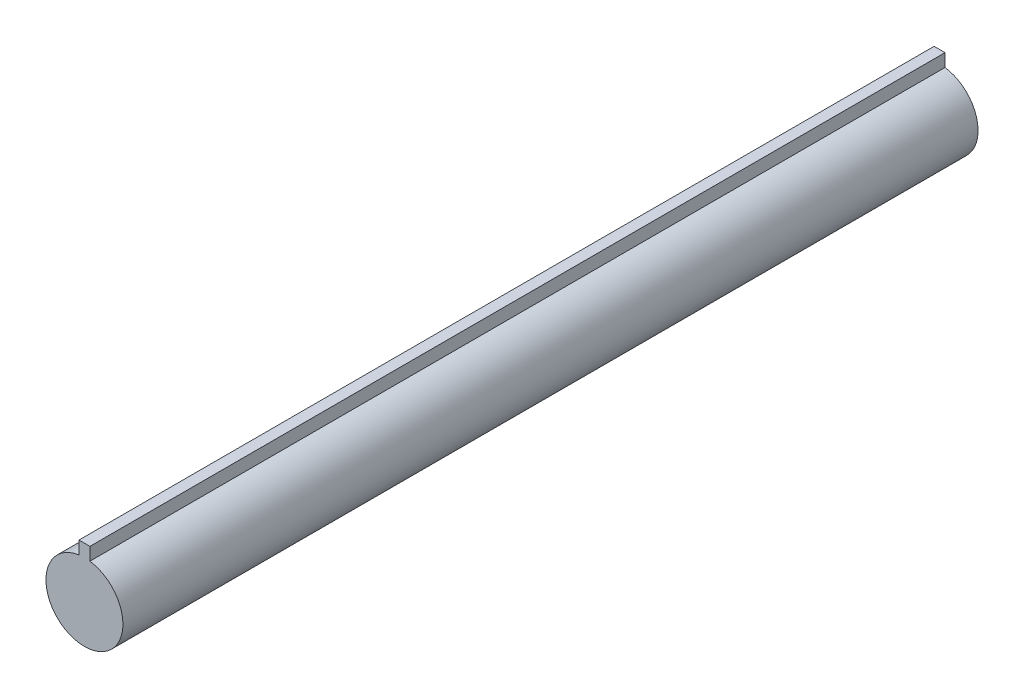
from build123d import *

# Parameters (mm, degrees)
EXTRUDE_1_DEPTH = 100


with BuildPart() as part:
    # 草图1 → 凸台-拉伸1 (new body)
    with BuildSketch(Plane.XY):
        with BuildLine():
            Line((-0.638725325, 4.454439354), (-0.638725325, 5.958965135))
            Line((-0.638725325, 5.958965135), (0.638725325, 5.958965135))
            Line((0.638725325, 5.958965135), (0.638725325, 4.454439354))
            ThreePointArc((0.638725325, 4.454439354), (0, -4.5), (-0.638725325, 4.454439354))
        make_face()
    extrude(amount=EXTRUDE_1_DEPTH)


solid = part.part
